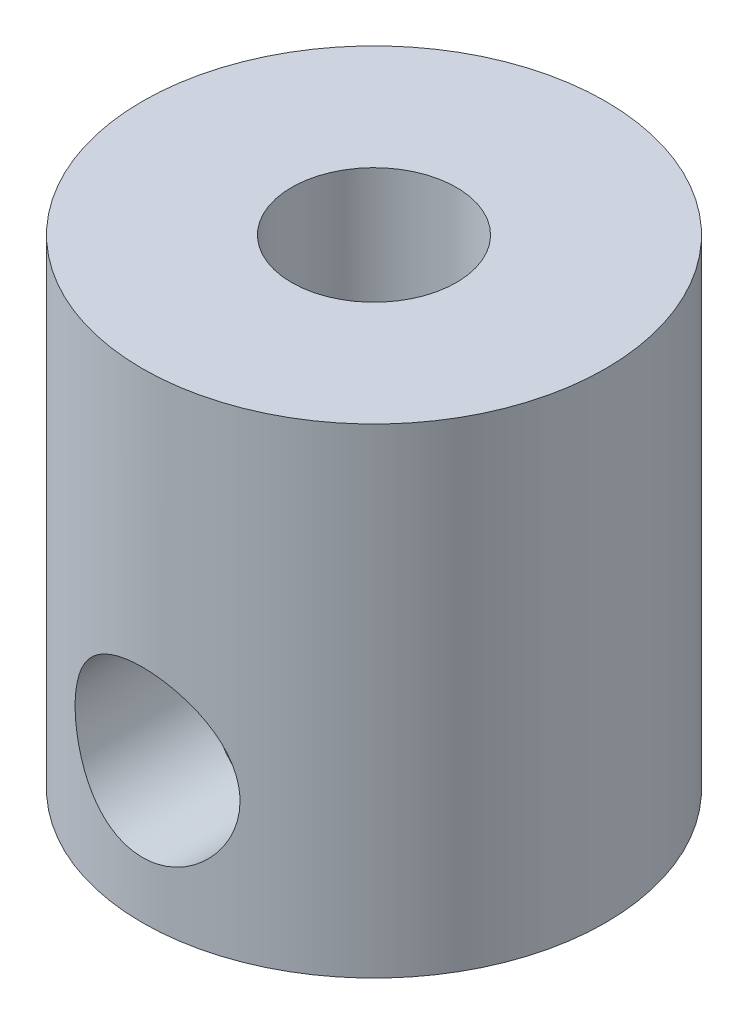
from build123d import *

# Parameters (mm, degrees)
SKETCH1_R                  = 3.175
BOSS_EXTRUDE1_DEPTH        = 6.5786
SKETCH2_R                  = 1.5875
CUT_EXTRUDE1_DEPTH         = 3.81
F_4_40_TAPPED_HOLE1_D      = 2.2606
F_4_40_TAPPED_HOLE1_DEPTH  = 12.7
F_4_40_TAPPED_HOLE1_TIP    = 0.679152758
F_4_40_TAPPED_HOLE2_REACH  = 11.679
F_4_40_TAPPED_HOLE2_BORE_R = 1.1303


with BuildPart() as part:
    # Sketch1 → Boss-Extrude1 (new body)
    with BuildSketch(Plane(origin=(0, 0, 0), x_dir=(1, 0, 0), z_dir=(0, 1, 0))):
        with Locations(Location((0, 0, 0), (0, 0, 270))):
            Circle(SKETCH1_R)
    extrude(amount=BOSS_EXTRUDE1_DEPTH)

    # Sketch2 → Cut-Extrude1 (cut)
    with BuildSketch(Plane.XZ):
        with Locations(Location((0, 0, 0), (0, 0, 270))):
            Circle(SKETCH2_R)
    extrude(amount=-CUT_EXTRUDE1_DEPTH, mode=Mode.SUBTRACT)

    # #4-40 Tapped Hole1
    with Locations(Plane(origin=(0, 6.5786, 0), x_dir=(1, 0, 0), z_dir=(0, 1, 0))):
        with Locations((0, 0)):
            Hole(F_4_40_TAPPED_HOLE1_D / 2, depth=F_4_40_TAPPED_HOLE1_DEPTH)
            with Locations((0, 0, -(F_4_40_TAPPED_HOLE1_DEPTH + F_4_40_TAPPED_HOLE1_TIP / 2))):  # 118° drill point
                Cone(0, F_4_40_TAPPED_HOLE1_D / 2, F_4_40_TAPPED_HOLE1_TIP, mode=Mode.SUBTRACT)

    # #4-40 Tapped Hole2 bore → #4-40 Tapped Hole2 (cut, up to next)
    with BuildSketch(Plane.XY.offset(3.175), mode=Mode.PRIVATE) as f_4_40_tapped_hole2_sk1:
        with Locations((0, 1.905)):
            Circle(F_4_40_TAPPED_HOLE2_BORE_R)
    f_4_40_tapped_hole2_tool1 = extrude(f_4_40_tapped_hole2_sk1.sketch, amount=-F_4_40_TAPPED_HOLE2_REACH, mode=Mode.PRIVATE) & part.part
    add(f_4_40_tapped_hole2_tool1.solids().sort_by_distance((0, 1.905, 3.175))[0], mode=Mode.SUBTRACT)


solid = part.part
